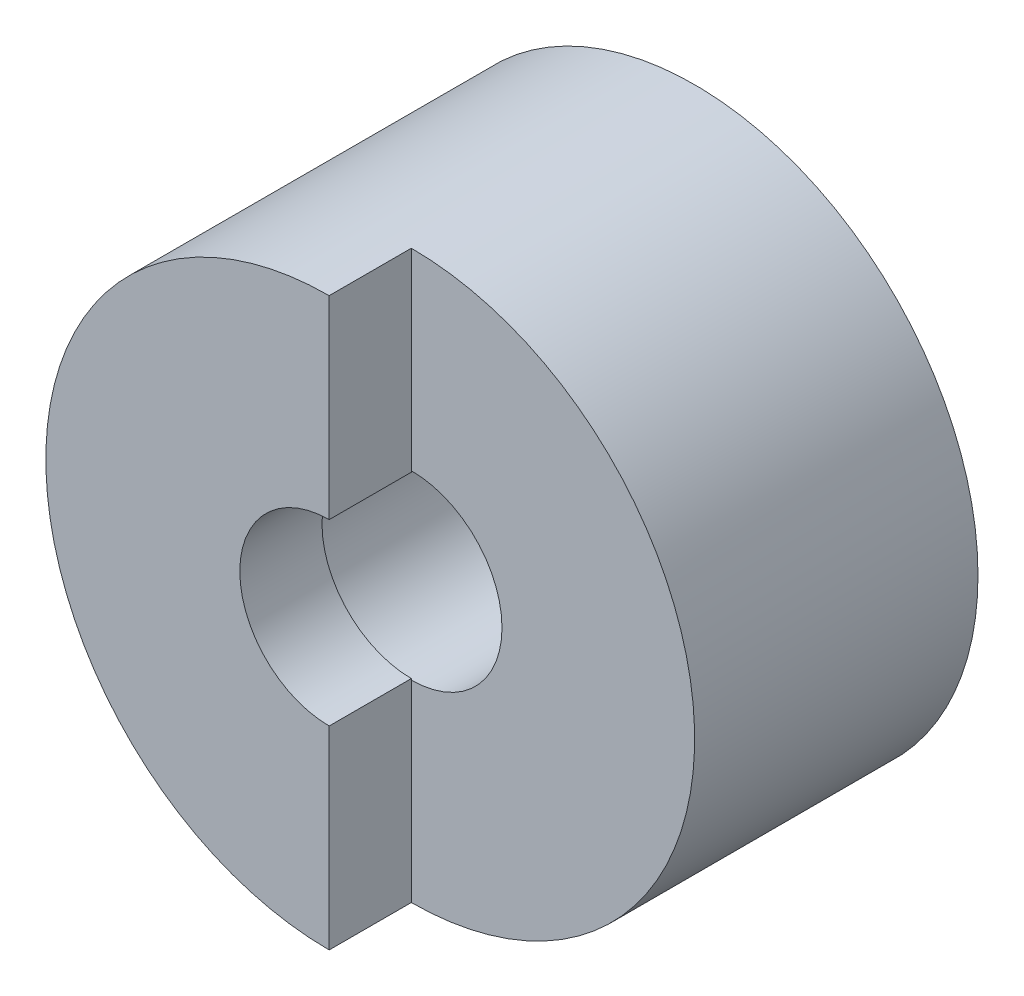
from build123d import *

# Parameters (mm, degrees)
SKETCH2_R           = 5
SKETCH2_R_2         = 1.6
BOSS_EXTRUDE1_DEPTH = 5
BOSS_EXTRUDE2_DEPTH = 1.45


with BuildPart() as part:
    # Sketch2 → Boss-Extrude1 (new body)
    with BuildSketch(Plane.XY):
        Circle(SKETCH2_R)
        Circle(SKETCH2_R_2, mode=Mode.SUBTRACT)
    extrude(amount=BOSS_EXTRUDE1_DEPTH)

    # Sketch3 → Boss-Extrude2 (add)
    with BuildSketch(Plane.XY.offset(5)):
        with BuildLine():
            Line((0, 1.576678565), (0, 5))
            ThreePointArc((0, 5), (-5, 0), (0, -5))
            Line((0, -5), (0, -1.576678565))
            ThreePointArc((0, -1.576678565), (-1.576678565, 0), (0, 1.576678565))
        make_face()
    extrude(amount=BOSS_EXTRUDE2_DEPTH)


solid = part.part
